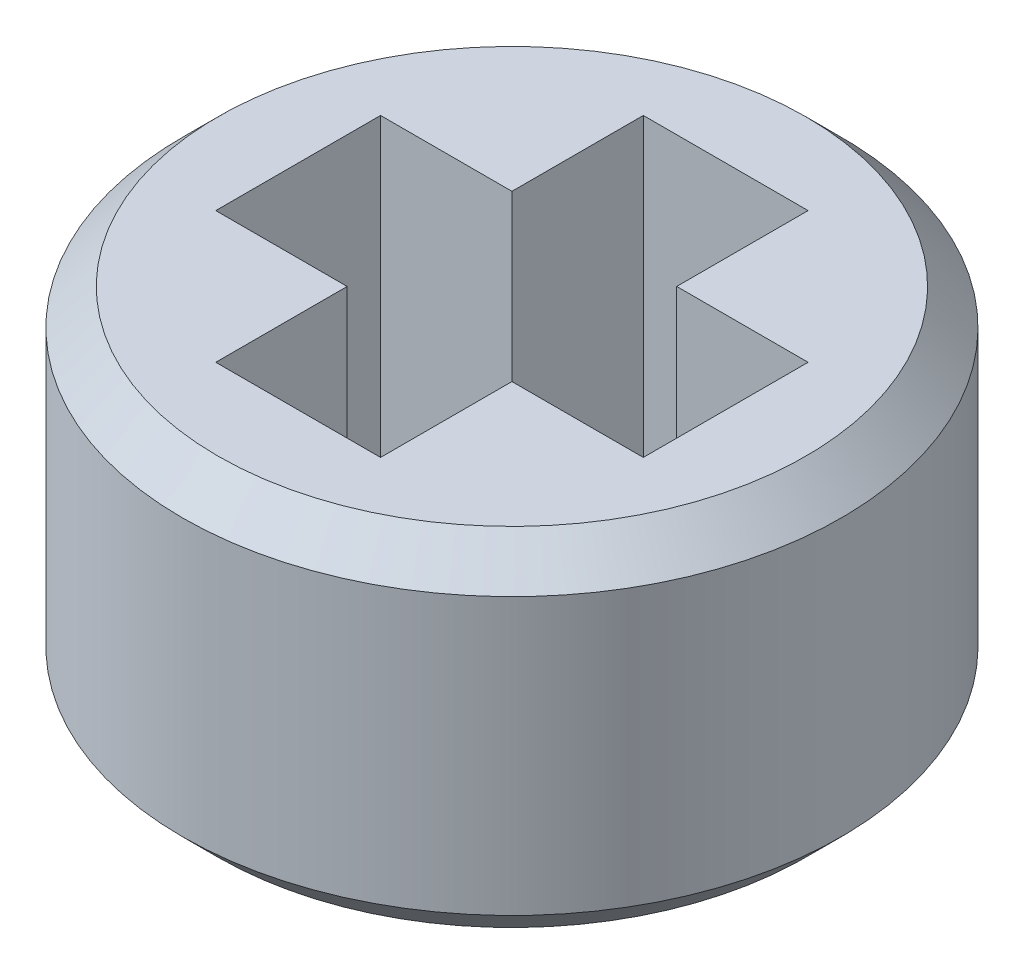
from build123d import *

# Parameters (mm, degrees)
SKETCH1_R           = 3.7
BOSS_EXTRUDE1_DEPTH = 1.95
CUT_EXTRUDE1_DEPTH  = 7.52610144
CHAMFER1_SIZE       = 0.4


with BuildPart() as part:
    # Sketch1 → Boss-Extrude1 (new, symmetric)
    with BuildSketch(Plane(origin=(0, 0, 0), x_dir=(1, 0, 0), z_dir=(0, 1, 0))):
        with Locations(Location((0, 0, 0), (0, 0, 270))):
            Circle(SKETCH1_R)
    extrude(amount=BOSS_EXTRUDE1_DEPTH, both=True)

    # Sketch2 → Cut-Extrude1 (cut, through all)
    with BuildSketch(Plane(origin=(0, 1.95, 0), x_dir=(1, 0, 0), z_dir=(0, 1, 0))):
        Polygon((0.925, 0.925), (2.4, 0.925), (2.4, -0.925), (0.925, -0.925), (0.925, -2.4), (-0.925, -2.4), (-0.925, -0.925), (-2.4, -0.925), (-2.4, 0.925), (-0.925, 0.925), (-0.925, 2.4), (0.925, 2.4), align=None)
    extrude(amount=-CUT_EXTRUDE1_DEPTH, mode=Mode.SUBTRACT)

    # Chamfer1
    chamfer1_edges = [part.edges().sort_by_distance(p)[0] for p in [
        (0, -1.95, -3.7),
        (0, 1.95, -3.7),
    ]]
    chamfer(chamfer1_edges, length=CHAMFER1_SIZE)


solid = part.part
